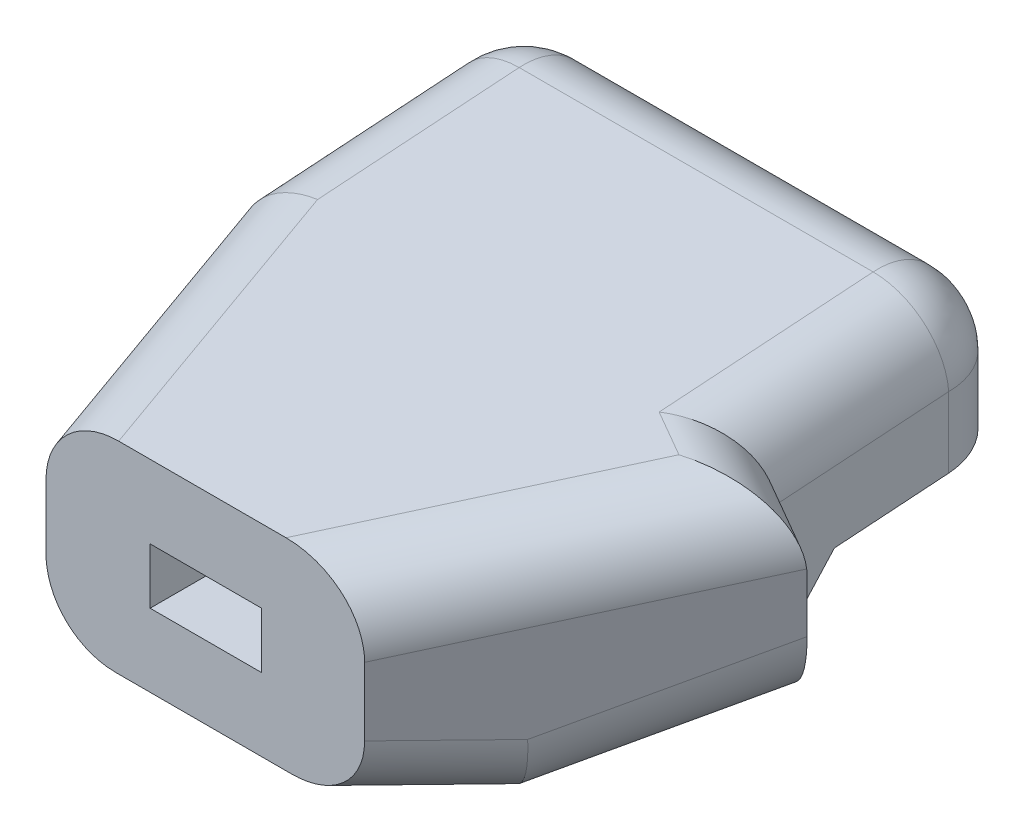
from build123d import *

# Parameters (mm, degrees)
EXTRUDE1_DEPTH     = 48.26
SKETCH3_OUTSIDE_W  = 133.914
SKETCH3_OUTSIDE_H  = 80.574
CUT_EXTRUDE1_DEPTH = 127
FILLET1_R          = 12.7
FILLET2_R          = 12.7
SKETCH8_W          = 20
SKETCH8_H          = 10
CUT_EXTRUDE2_DEPTH = 12.7


with BuildPart() as part:
    # Sketch1 → Extrude1 (new body)
    with BuildSketch(Plane(origin=(0, 0, 0), x_dir=(1, 0, 0), z_dir=(0, 1, 0))):
        Polygon((-44.45, 101.6), (44.45, 101.6), (44.45, 57.94375), (57.15, 50.8), (28.575, 0), (-28.575, 0), (-44.45, 50.8), align=None)
    extrude(amount=EXTRUDE1_DEPTH)

    # Sketch3 outside → Cut-Extrude1 (cut, symmetric)
    with BuildSketch(Plane.ZY.offset(44.45)):
        with Locations((-50.8, 24.13)):
            Rectangle(SKETCH3_OUTSIDE_W, SKETCH3_OUTSIDE_H)
        Polygon((0, 41.445288221), (-101.6, 48.26), (-101.6, 22.86), (-68.397585835, 20.632983436), (-57.94375, 9.084619968), (-25.4, 0), (0, 5.240594668), align=None, mode=Mode.SUBTRACT)
    extrude(amount=CUT_EXTRUDE1_DEPTH, both=True, mode=Mode.SUBTRACT)

    # Fillet1
    fillet1_edges = [part.edges().sort_by_distance(p)[0] for p in [
        (-44.45, 35.56, -101.6),
        (-44.45, 46.556322055, -76.2),
        (42.8625, 43.148966165, -25.4),
        (0, 48.26, -101.6),
        (50.8, 45.092223821, -54.371875),
        (44.45, 35.56, -101.6),
        (44.45, 46.795901766, -79.771875),
        (-36.5125, 43.148966165, -25.4),
    ]]
    fillet(fillet1_edges, radius=FILLET1_R)

    # Fillet2
    fillet2_edges = [part.edges().sort_by_distance(p)[0] for p in [
        (-40.48125, 3.545217548, -38.1),
        (-32.54375, 2.620297334, -12.7),
        (50.00625, 3.545217548, -38.1),
        (35.71875, 2.620297334, -12.7),
    ]]
    fillet(fillet2_edges, radius=FILLET2_R)

    # Sketch8 → Cut-Extrude2 (cut)
    with BuildSketch(Plane.XY):
        with Locations((0.104168421, 23.306375587)):
            Rectangle(SKETCH8_W, SKETCH8_H)
    extrude(amount=-CUT_EXTRUDE2_DEPTH, mode=Mode.SUBTRACT)


solid = part.part
